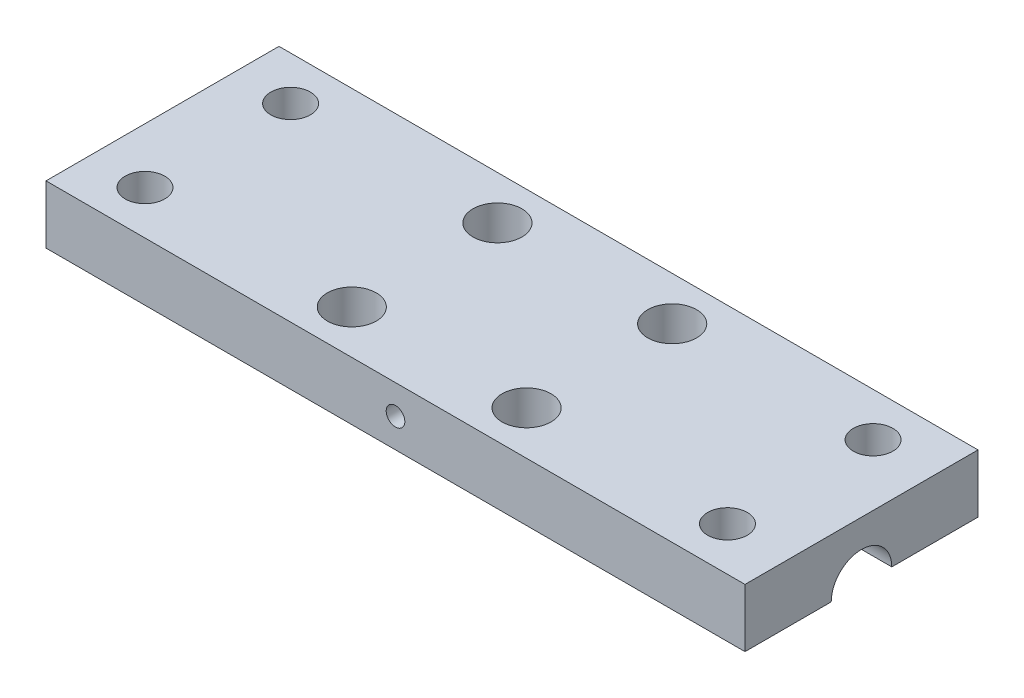
from build123d import *

# Parameters (mm, degrees)
SKETCH1_W           = 76.2
SKETCH1_H           = 25.4
BOSS_EXTRUDE1_DEPTH = 6.35
SKETCH2_R           = 2.159
CUT_EXTRUDE1_DEPTH  = 41.659838908
SKETCH3_R           = 2.667
CUT_EXTRUDE2_DEPTH  = 41.659838908
SKETCH4_R           = 1.016
CUT_EXTRUDE3_DEPTH  = 7.62
CUT_EXTRUDE4_START  = -7.62
SKETCH5_R           = 1.016
CUT_EXTRUDE4_DEPTH  = 7.62
SKETCH7_R           = 3.302
CUT_EXTRUDE5_DEPTH  = 78.51162816


with BuildPart() as part:
    # Sketch1 → Boss-Extrude1 (new body)
    with BuildSketch(Plane(origin=(0, 0, 0), x_dir=(1, 0, 0), z_dir=(0, 1, 0))):
        Rectangle(SKETCH1_W, SKETCH1_H)
    extrude(amount=BOSS_EXTRUDE1_DEPTH)

    # Sketch2 → Cut-Extrude1 (cut, through all)
    with BuildSketch(Plane(origin=(0, 6.35, 0), x_dir=(1, 0, 0), z_dir=(0, 1, 0))):
        with Locations(Location((-32.074075882, 7.9375, 0), (0, 0, 270))):
            Circle(SKETCH2_R)
        with Locations(Location((-32.074075882, -7.9375, 0), (0, 0, 270))):
            Circle(SKETCH2_R)
        with Locations(Location((31.425924118, 7.9375, 0), (0, 0, 270))):
            Circle(SKETCH2_R)
        with Locations(Location((31.425924118, -7.9375, 0), (0, 0, 270))):
            Circle(SKETCH2_R)
    extrude(amount=-CUT_EXTRUDE1_DEPTH, mode=Mode.SUBTRACT)

    # Sketch3 → Cut-Extrude2 (cut, through all)
    with BuildSketch(Plane(origin=(0, 6.35, 0), x_dir=(1, 0, 0), z_dir=(0, 1, 0))):
        with Locations(Location((-9.525, 7.9375, 0), (0, 0, 270))):
            Circle(SKETCH3_R)
        with Locations(Location((-9.525, -7.9375, 0), (0, 0, 270))):
            Circle(SKETCH3_R)
        with Locations(Location((9.525, 7.9375, 0), (0, 0, 270))):
            Circle(SKETCH3_R)
        with Locations(Location((9.525, -7.9375, 0), (0, 0, 270))):
            Circle(SKETCH3_R)
    extrude(amount=-CUT_EXTRUDE2_DEPTH, mode=Mode.SUBTRACT)

    # Sketch4 → Cut-Extrude3 (cut)
    with BuildSketch(Plane.XY.offset(12.7)):
        with Locations((0, 3.175)):
            Circle(SKETCH4_R)
    extrude(amount=-CUT_EXTRUDE3_DEPTH, mode=Mode.SUBTRACT)

    # Sketch5 → Cut-Extrude4 (cut)
    with BuildSketch(Plane(origin=(0, 0, -12.7), x_dir=(-1, 0, 0), z_dir=(0, 0, -1)).offset(CUT_EXTRUDE4_START)):
        with Locations(Location((0, 3.175, 0), (0, 0, 180))):
            Circle(SKETCH5_R)
    extrude(amount=CUT_EXTRUDE4_DEPTH, mode=Mode.SUBTRACT)

    # Sketch7 → Cut-Extrude5 (cut, through all)
    with BuildSketch(Plane(origin=(38.1, 0, 0), x_dir=(0, 0, -1), z_dir=(1, 0, 0))):
        Circle(SKETCH7_R)
    extrude(amount=-CUT_EXTRUDE5_DEPTH, mode=Mode.SUBTRACT)


solid = part.part
